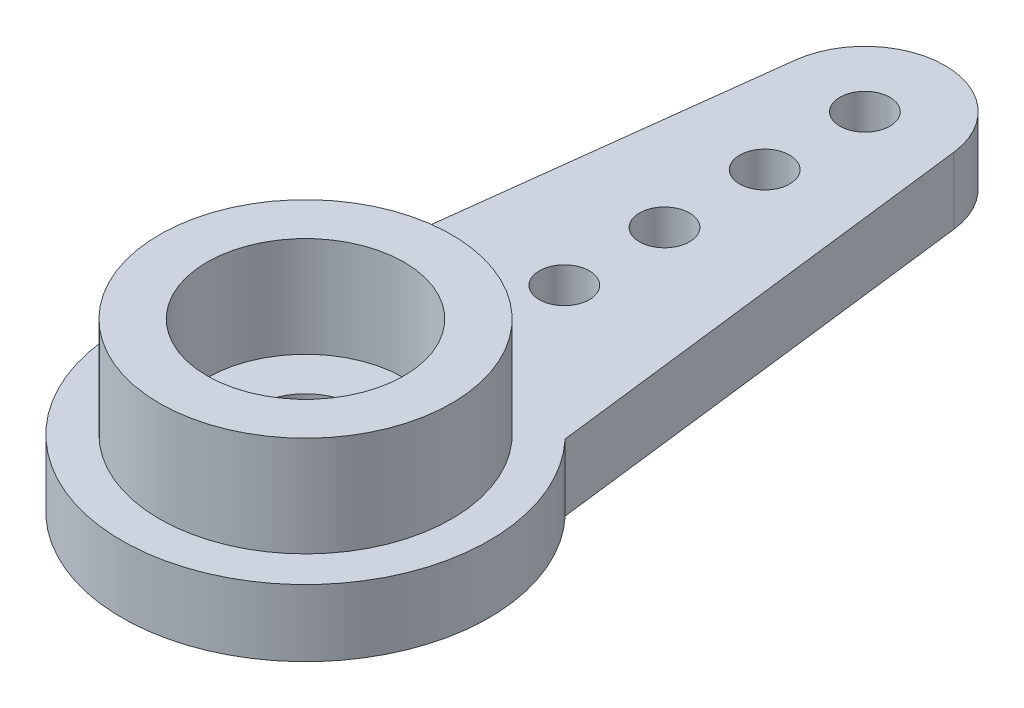
from build123d import *

# Parameters (mm, degrees)
CROQUIS1_R              = 0.75
CROQUIS1_R_2            = 1.5
SALIENTE_EXTRUIR1_DEPTH = 2
CROQUIS2_R              = 4.375
CROQUIS2_R_2            = 2.95
SALIENTE_EXTRUIR2_DEPTH = 3


with BuildPart() as part:
    # Croquis1 → Saliente-Extruir1 (new body)
    with BuildSketch(Plane(origin=(0, 0, 0), x_dir=(1, 0, 0), z_dir=(0, 1, 0))):
        with BuildLine():
            Line((-4, 3.774917218), (-2.382352433, 17.040511421))
            ThreePointArc((-2.382352433, 17.040511421), (0, 19.15), (2.382352433, 17.040511421))
            Line((2.382352433, 17.040511421), (4, 3.774917218))
            ThreePointArc((4, 3.774917218), (0, -5.5), (-4, 3.774917218))
        make_face()
        with Locations(Location((0, 16.75, 0), (0, 0, 270))):
            Circle(CROQUIS1_R, mode=Mode.SUBTRACT)
        with Locations(Location((0, 13.75, 0), (0, 0, 270))):
            Circle(CROQUIS1_R, mode=Mode.SUBTRACT)
        with Locations(Location((0, 10.75, 0), (0, 0, 270))):
            Circle(CROQUIS1_R, mode=Mode.SUBTRACT)
        with Locations(Location((0, 7.75, 0), (0, 0, 270))):
            Circle(CROQUIS1_R, mode=Mode.SUBTRACT)
        with Locations(Location((0, 0, 0), (0, 0, 270))):
            Circle(CROQUIS1_R_2, mode=Mode.SUBTRACT)
    extrude(amount=SALIENTE_EXTRUIR1_DEPTH)

    # Croquis2 → Saliente-Extruir2 (add)
    with BuildSketch(Plane(origin=(0, 2, 0), x_dir=(1, 0, 0), z_dir=(0, 1, 0))):
        with Locations(Location((0, 0, 0), (0, 0, 270))):
            Circle(CROQUIS2_R)
        with Locations(Location((0, 0, 0), (0, 0, 270))):
            Circle(CROQUIS2_R_2, mode=Mode.SUBTRACT)
    extrude(amount=SALIENTE_EXTRUIR2_DEPTH)


solid = part.part
